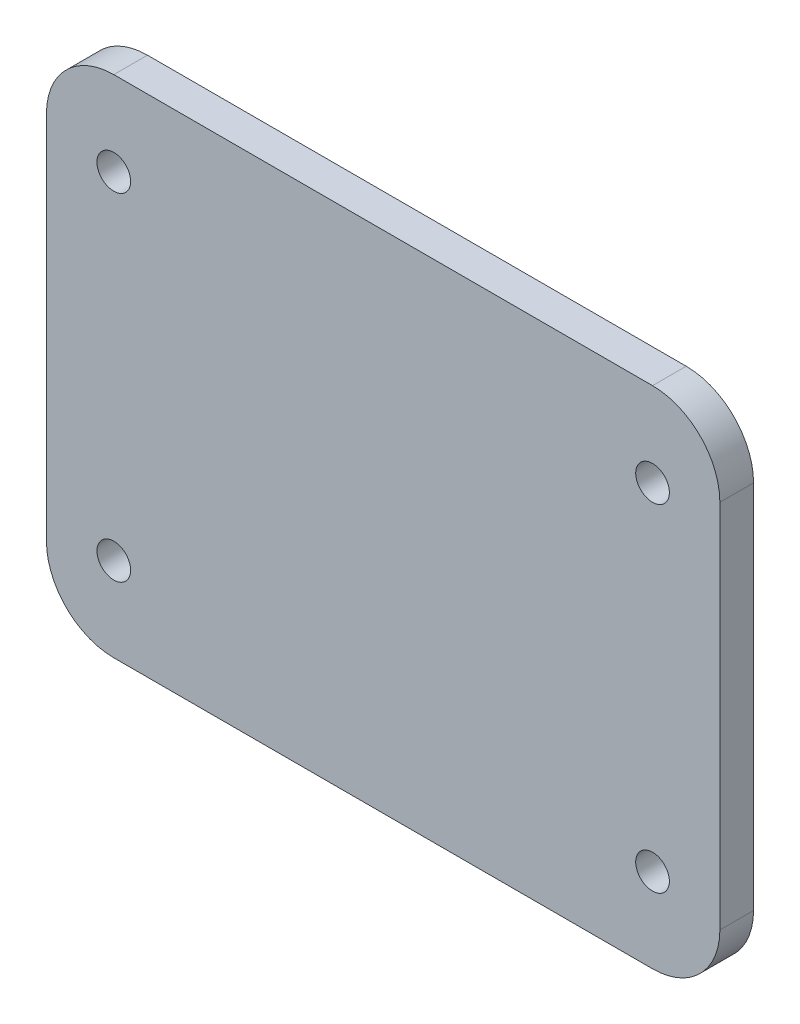
from build123d import *

# Parameters (mm, degrees)
SKETCH1_R           = 12.5
BOSS_EXTRUDE1_DEPTH = 2.5
SKETCH2_R           = 2.5
CUT_EXTRUDE1_DEPTH  = 63.69968102
SKETCH5_R           = 12.5
BOSS_EXTRUDE2_DEPTH = 2.5


with BuildPart() as part:
    # Sketch1 → Boss-Extrude1 (new, symmetric)
    with BuildSketch(Plane.XY):
        with BuildLine():
            Line((-40, -37.5), (40, -37.5))
            ThreePointArc((40, -37.5), (47.071067812, -34.571067812), (50, -27.5))
            Line((50, -27.5), (50, 27.5))
            ThreePointArc((50, 27.5), (47.071067812, 34.571067812), (40, 37.5))
            Line((40, 37.5), (-40, 37.5))
            ThreePointArc((-40, 37.5), (-47.071067812, 34.571067812), (-50, 27.5))
            Line((-50, 27.5), (-50, -27.5))
            ThreePointArc((-50, -27.5), (-47.071067812, -34.571067812), (-40, -37.5))
        make_face()
        Circle(SKETCH1_R, mode=Mode.SUBTRACT)
    extrude(amount=BOSS_EXTRUDE1_DEPTH, both=True)

    # Sketch2 → Cut-Extrude1 (cut, through all)
    with BuildSketch(Plane.XY.offset(2.5)):
        with Locations((40, 25)):
            Circle(SKETCH2_R)
        with Locations((-40, 25)):
            Circle(SKETCH2_R)
        with Locations((-40, -25)):
            Circle(SKETCH2_R)
        with Locations((40, -25)):
            Circle(SKETCH2_R)
    extrude(amount=-CUT_EXTRUDE1_DEPTH, mode=Mode.SUBTRACT)

    # Sketch5 → Boss-Extrude2 (add, symmetric)
    with BuildSketch(Plane.XY):
        Circle(SKETCH5_R)
    extrude(amount=BOSS_EXTRUDE2_DEPTH, both=True)


solid = part.part
